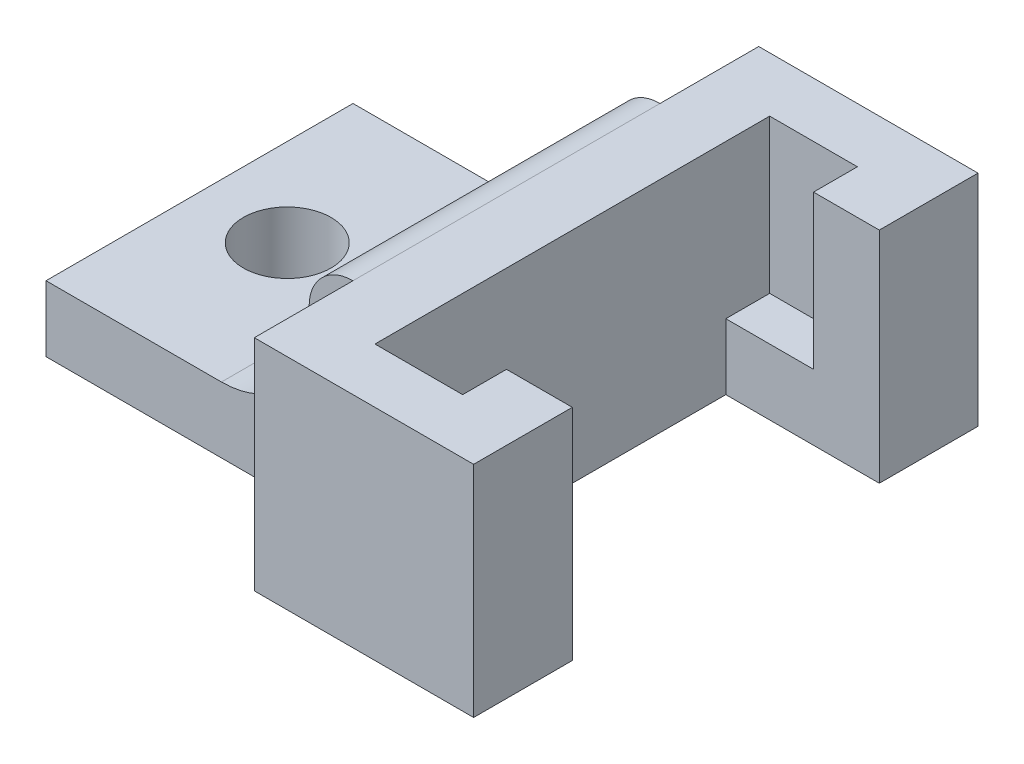
from build123d import *

# Parameters (mm, degrees)
SKETCH1_W           = 14
SKETCH1_H           = 14
SKETCH1_R           = 2
BOSS_EXTRUDE1_DEPTH = 10
SKETCH3_W           = 4
SKETCH3_H           = 18
SKETCH3_W_2         = 12
SKETCH3_H_2         = 14
CUT_EXTRUDE1_DEPTH  = 7
FILLET1_R           = 4
FILLET2_R           = 2
SKETCH4_W           = 2
SKETCH4_H           = 9
BOSS_EXTRUDE2_DEPTH = 4
FILLET3_R           = 2


with BuildPart() as part:
    # Sketch1 → Boss-Extrude1 (new body)
    # profile 1 of 2: a face of its own
    with BuildSketch(Plane(origin=(0, 0, 0), x_dir=(1, 0, 0), z_dir=(0, 1, 0))):
        Polygon((14, 14), (14, 0), (14, -4.5), (24, -4.5), (24, 0), (17, 0), (17, 14), (24, 14), (24, 18.5), (14, 18.5), align=None)
    # profile 2 of 2: a face of its own
    with BuildSketch(Plane(origin=(0, 0, 0), x_dir=(1, 0, 0), z_dir=(0, 1, 0))):
        with Locations((7, 7)):
            Rectangle(SKETCH1_W, SKETCH1_H)
        with Locations(Location((4, 7, 0), (0, 0, 270))):
            Circle(SKETCH1_R, mode=Mode.SUBTRACT)
    extrude(amount=BOSS_EXTRUDE1_DEPTH)

    # Sketch3 → Cut-Extrude1 (cut)
    with BuildSketch(Plane(origin=(0, 10, 0), x_dir=(1, 0, 0), z_dir=(0, 1, 0))):
        with Locations((19, 7)):
            Rectangle(SKETCH3_W, SKETCH3_H)
        with Locations((6, 7)):
            Rectangle(SKETCH3_W_2, SKETCH3_H_2)
    extrude(amount=-CUT_EXTRUDE1_DEPTH, mode=Mode.SUBTRACT)

    # Fillet1
    fillet1_edges = [part.edges().sort_by_distance(p)[0] for p in [
        (12, 3, -7),
    ]]
    fillet(fillet1_edges, radius=FILLET1_R)

    # Fillet2
    fillet2_edges = [part.edges().sort_by_distance(p)[0] for p in [
        (12, 10, -7),
    ]]
    fillet(fillet2_edges, radius=FILLET2_R)

    # Sketch4 → Boss-Extrude2 (add)
    with BuildSketch(Plane.XZ):
        with Locations((8.05, -7)):
            Rectangle(SKETCH4_W, SKETCH4_H)
    extrude(amount=BOSS_EXTRUDE2_DEPTH)

    # Fillet3
    fillet3_edges = [part.edges().sort_by_distance(p)[0] for p in [
        (9.05, 0, -7),
    ]]
    fillet(fillet3_edges, radius=FILLET3_R)


solid = part.part
